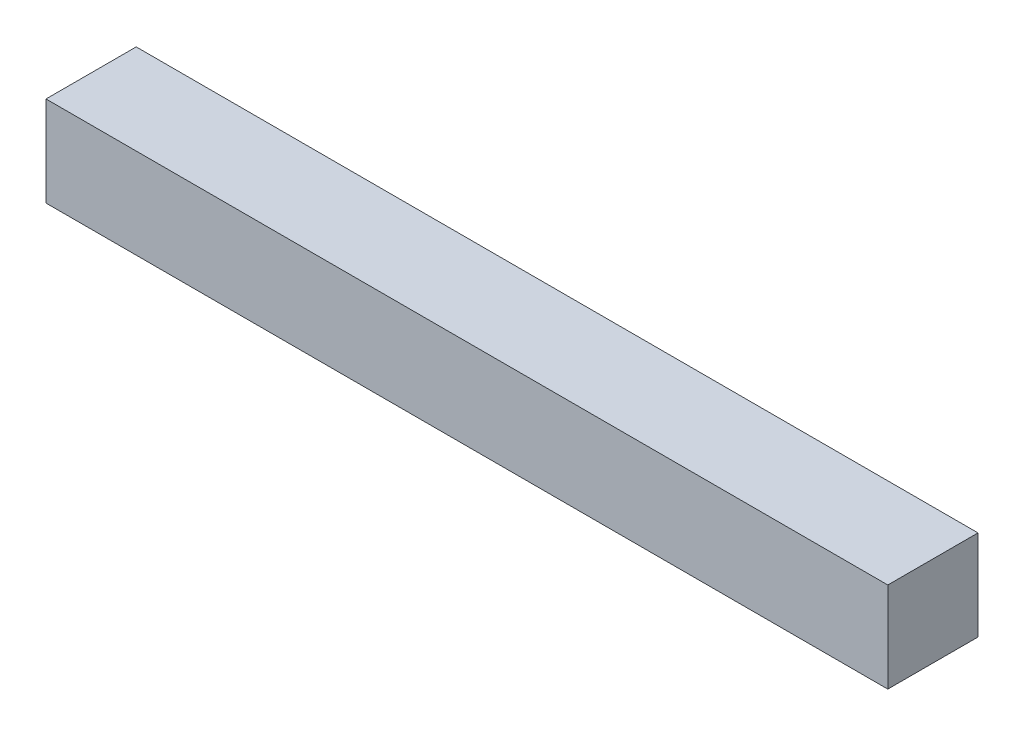
from build123d import *

# Parameters (mm, degrees)
SKIZZE1_W                       = 280
SKIZZE1_H                       = 30
AUFSATZ_LINEAR_AUSTRAGEN1_DEPTH = 30


with BuildPart() as part:
    # Skizze1 → Aufsatz-Linear austragen1 (new body)
    with BuildSketch(Plane.XY):
        Rectangle(SKIZZE1_W, SKIZZE1_H)
    extrude(amount=AUFSATZ_LINEAR_AUSTRAGEN1_DEPTH)


solid = part.part
